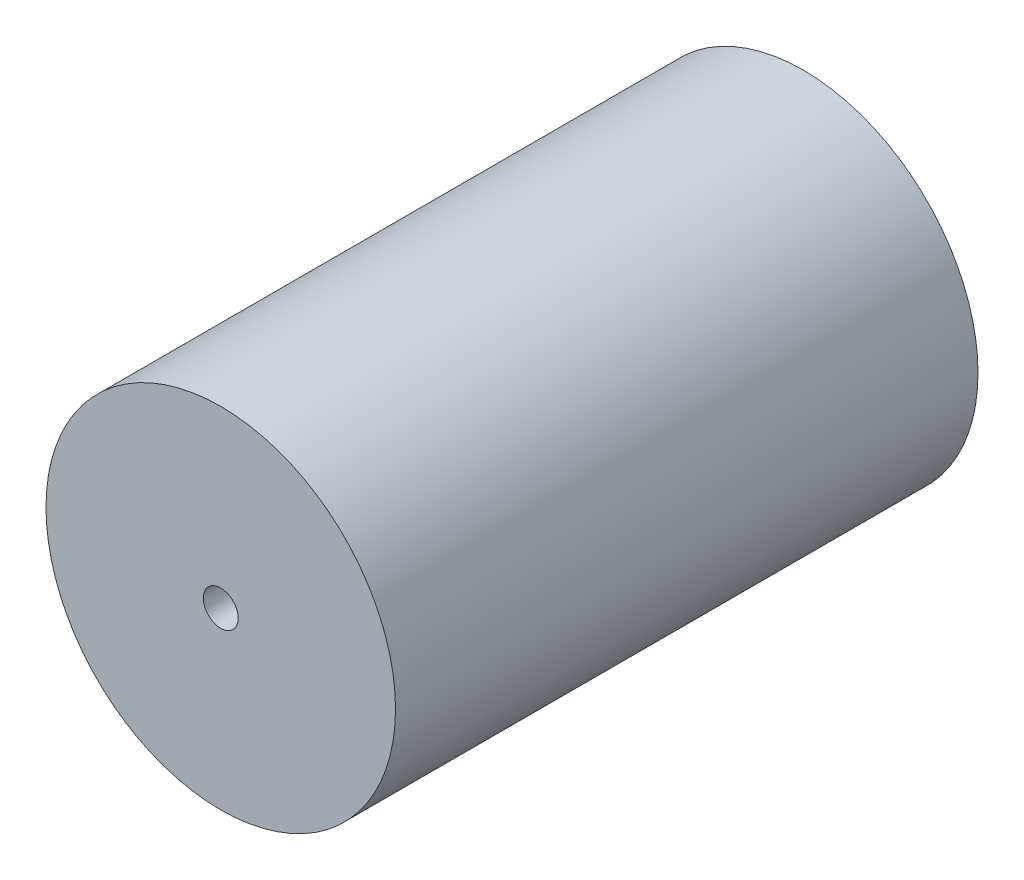
from build123d import *

# Parameters (mm, degrees)
SKETCH1_R           = 150
SKETCH1_R_2         = 15
BOSS_EXTRUDE1_DEPTH = 500


with BuildPart() as part:
    # Sketch1 → Boss-Extrude1 (new body)
    with BuildSketch(Plane.XY):
        with Locations((0, 5.616617465)):
            Circle(SKETCH1_R)
        with Locations((0, 5.616617465)):
            Circle(SKETCH1_R_2, mode=Mode.SUBTRACT)
    extrude(amount=BOSS_EXTRUDE1_DEPTH)


solid = part.part
